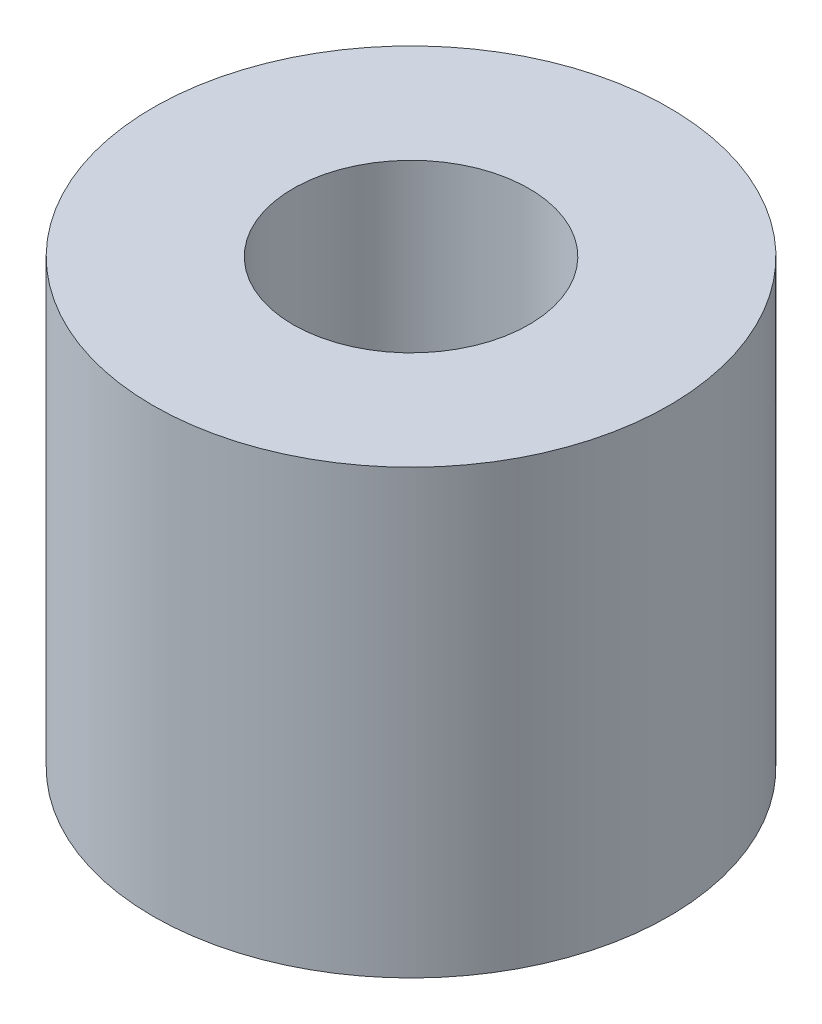
from build123d import *

# Parameters (mm, degrees)
SKETCH_1_R        = 1.75
EXTRUDE_1_DEPTH   = 3
HOLE_WIZARD_M21_D = 1.6


with BuildPart() as part:
    # Эскиз1 → Бобышка-Вытянуть1 (new body)
    with BuildSketch(Plane(origin=(0, 0, 0), x_dir=(1, 0, 0), z_dir=(0, 1, 0))):
        with Locations(Location((0, 0, 0), (0, 0, 270))):
            Circle(SKETCH_1_R)
    extrude(amount=EXTRUDE_1_DEPTH)

    # Отверстие обработанное метчиком M21 (through all)
    with Locations(Plane(origin=(0, 3, 0), x_dir=(1, 0, 0), z_dir=(0, 1, 0))):
        with Locations((0, 0)):
            Hole(HOLE_WIZARD_M21_D / 2)


solid = part.part
